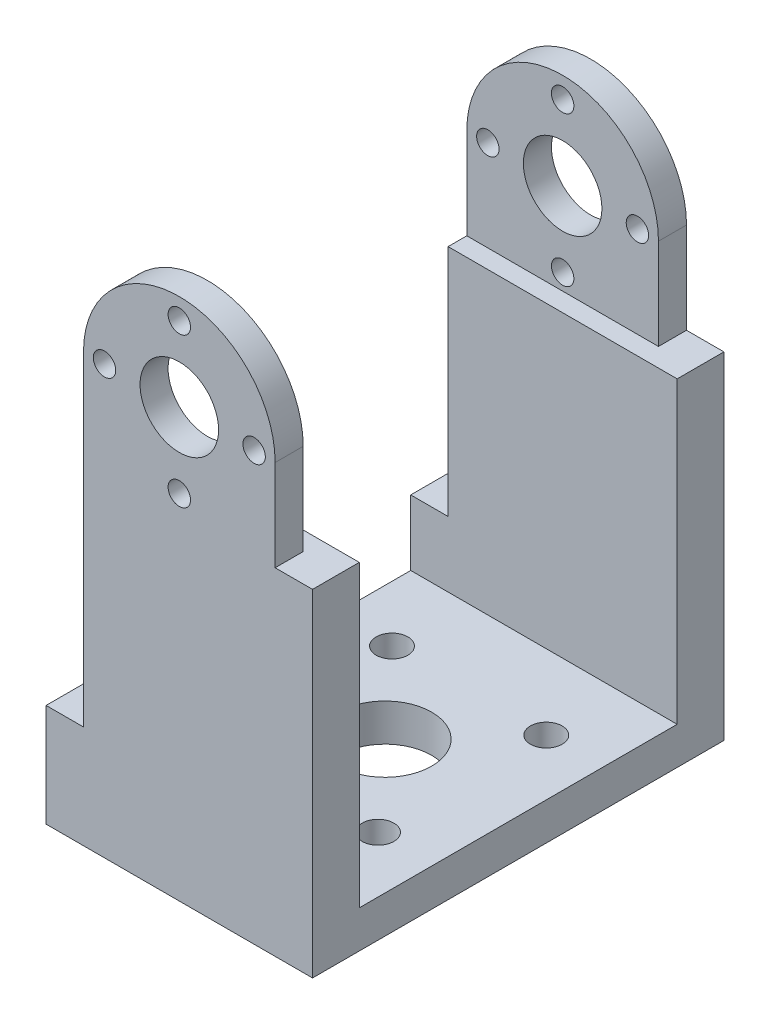
from build123d import *

# Parameters (mm, degrees)
BOSS_EXTRUDE1_DEPTH      = 22
BOSS_EXTRUDE1_DEPTH_BACK = 22
SKETCH1_R                = 1.2
SKETCH1_R_2              = 4.2
SKETCH2_W                = 38
SKETCH2_H                = 20
CUT_EXTRUDE1_DEPTH       = 105.423416914
SKETCH3_W                = 7
SKETCH3_H                = 44
BOSS_EXTRUDE2_DEPTH      = 36
SKETCH5_W                = 34
SKETCH5_H                = 50
CUT_EXTRUDE3_DEPTH       = 109.047443283
SKETCH6_W                = 20.5
SKETCH6_H                = 54.25
CUT_EXTRUDE4_DEPTH       = 111.605436123
SKETCH20_W               = 28.5
SKETCH20_H               = 34
SKETCH20_R               = 1.7
SKETCH20_R_2             = 5
BOSS_EXTRUDE5_DEPTH      = 4
SKETCH21_W               = 3
SKETCH21_H               = 36
CUT_EXTRUDE12_DEPTH      = 66.777085676
SKETCH22_W               = 4
SKETCH22_H               = 25
CUT_EXTRUDE14_DEPTH      = 66.054784605


with BuildPart() as part:
    # Sketch1 → Boss-Extrude1 (new, two sides: drawn at the far end of the back side and taken through both)
    with BuildSketch(Plane.XY.offset(-BOSS_EXTRUDE1_DEPTH_BACK)):
        with BuildLine():
            ThreePointArc((10.25, 0), (0, 10.25), (-10.25, 0))
            Line((-10.25, 0), (-10.25, -100))
            Line((-10.25, -100), (10.25, -100))
            Line((10.25, -100), (10.25, 0))
        make_face()
        with Locations((8, 0)):
            Circle(SKETCH1_R, mode=Mode.SUBTRACT)
        with Locations((0, 8)):
            Circle(SKETCH1_R, mode=Mode.SUBTRACT)
        with Locations((-8, 0)):
            Circle(SKETCH1_R, mode=Mode.SUBTRACT)
        Circle(SKETCH1_R_2, mode=Mode.SUBTRACT)
        with Locations((0, -8)):
            Circle(SKETCH1_R, mode=Mode.SUBTRACT)
    extrude(amount=BOSS_EXTRUDE1_DEPTH + BOSS_EXTRUDE1_DEPTH_BACK)

    # Sketch2 → Cut-Extrude1 (cut, through all)
    with BuildSketch(Plane.ZY.offset(10.25)):
        with Locations((0, 0.25)):
            Rectangle(SKETCH2_W, SKETCH2_H)
    extrude(amount=-CUT_EXTRUDE1_DEPTH, mode=Mode.SUBTRACT)

    # Sketch3 → Boss-Extrude2 (add)
    with BuildSketch(Plane(origin=(0, -9.75, 0), x_dir=(1, 0, 0), z_dir=(0, 1, 0))):
        with Locations((-13.75, 0)):
            Rectangle(SKETCH3_W, SKETCH3_H)
        with Locations((13.75, 0)):
            Rectangle(SKETCH3_W, SKETCH3_H)
    extrude(amount=-BOSS_EXTRUDE2_DEPTH)

    # Sketch5 → Cut-Extrude3 (cut, through all)
    with BuildSketch(Plane.ZY.offset(17.25)):
        with Locations((0, -34.75)):
            Rectangle(SKETCH5_W, SKETCH5_H)
    extrude(amount=-CUT_EXTRUDE3_DEPTH, mode=Mode.SUBTRACT)

    # Sketch6 → Cut-Extrude4 (cut, through all)
    with BuildSketch(Plane.XY.offset(22)):
        with Locations((0, -72.875)):
            Rectangle(SKETCH6_W, SKETCH6_H)
    extrude(amount=-CUT_EXTRUDE4_DEPTH, mode=Mode.SUBTRACT)


with BuildPart() as cut_extrude4_piece_1:
    # of the separate pieces the step leaves, piece 1, a body of its own (cut_extrude4_pieces)
    add(part.part.solids().sort_by_distance((17.25, -45.75, -17))[0])



with BuildPart() as cut_extrude4_piece_2:
    # of the separate pieces the step leaves, piece 2, a body of its own (cut_extrude4_pieces)
    add(part.part.solids().sort_by_distance((-10.25, 0, 22))[0])


with BuildPart() as cut_extrude4_piece_1_1:
    add(cut_extrude4_piece_1.part)

    add(cut_extrude4_piece_2.part)  # Boss-Extrude5 merges Cut-Extrude4 piece 2
    # Sketch20 → Boss-Extrude5 (add)
    with BuildSketch(Plane.XZ.offset(45.75)):
        Rectangle(SKETCH20_W, SKETCH20_H)
        with Locations((-8.25, -9)):
            Circle(SKETCH20_R, mode=Mode.SUBTRACT)
        with Locations((8.25, -9)):
            Circle(SKETCH20_R, mode=Mode.SUBTRACT)
        with Locations((-8.25, 9)):
            Circle(SKETCH20_R, mode=Mode.SUBTRACT)
        Circle(SKETCH20_R_2, mode=Mode.SUBTRACT)
        with Locations((8.25, 9)):
            Circle(SKETCH20_R, mode=Mode.SUBTRACT)
    extrude(amount=-BOSS_EXTRUDE5_DEPTH)

    # Sketch21 → Cut-Extrude12 (cut, through all)
    with BuildSketch(Plane(origin=(0, 0, -22), x_dir=(-1, 0, 0), z_dir=(0, 0, -1))):
        with Locations((-15.75, -27.75)):
            Rectangle(SKETCH21_W, SKETCH21_H)
        with Locations((15.75, -27.75)):
            Rectangle(SKETCH21_W, SKETCH21_H)
    extrude(amount=-CUT_EXTRUDE12_DEPTH, mode=Mode.SUBTRACT)

    # Sketch22 → Cut-Extrude14 (cut, through all)
    with BuildSketch(Plane(origin=(0, 0, -22), x_dir=(-1, 0, 0), z_dir=(0, 0, -1))):
        with Locations((12.25, -22.25)):
            Rectangle(SKETCH22_W, SKETCH22_H)
    extrude(amount=-CUT_EXTRUDE14_DEPTH, mode=Mode.SUBTRACT)


solid = cut_extrude4_piece_1_1.part
